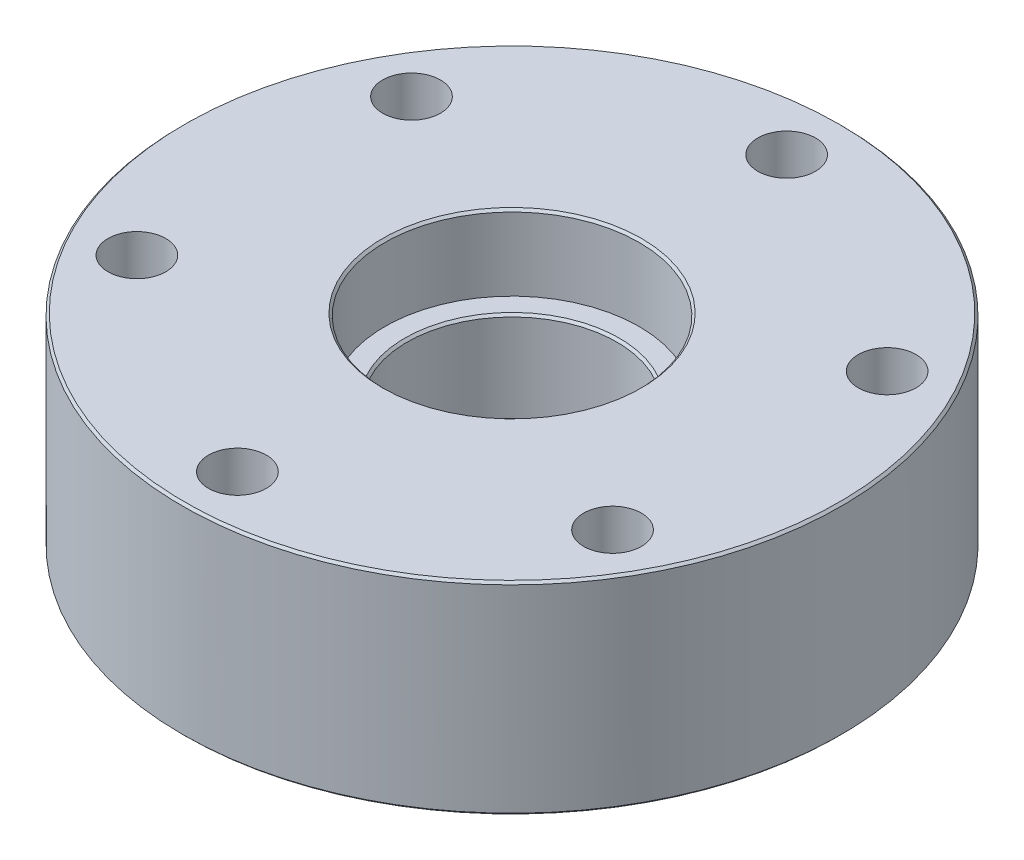
from build123d import *

# Parameters (mm, degrees)
SKETCH_3_R          = 2.5
CUT_EXTRUDE_1_DEPTH = 17.5
CHAMFER_1_SIZE      = 0.2


with BuildPart() as part:
    # ｽｹｯﾁ2 → 回転1 (revolve)
    with BuildSketch(Plane.XY, mode=Mode.PRIVATE) as revolve_1_sk:
        Polygon((-9.075, 10.244997288), (-9.075, 2.244997288), (-11, 2.244997288), (-11, -0.755002712), (-28.5, -0.755002712), (-28.5, 16.744997288), (-11, 16.744997288), (-11, 10.244997288), align=None)
    revolve(revolve_1_sk.sketch.rotate(Axis((0, 0, 0), (0, 1, 0)), 270), axis=Axis((0, 0, 0), (0, 1, 0)))

    # ｽｹｯﾁ3 → ｶｯﾄ - 押し出し1 (cut)
    with BuildSketch(Plane(origin=(0, 16.744997288, 0), x_dir=(1, 0, 0), z_dir=(0, 1, 0))):
        with Locations(Location((0, 23.75, 0), (0, 0, 270))):
            Circle(SKETCH_3_R)
        with Locations(Location((20.56810334, 11.875, 0), (0, 0, 270))):
            Circle(SKETCH_3_R)
        with Locations(Location((20.56810334, -11.875, 0), (0, 0, 270))):
            Circle(SKETCH_3_R)
        with Locations(Location((0, -23.75, 0), (0, 0, 270))):
            Circle(SKETCH_3_R)
        with Locations(Location((-20.56810334, -11.875, 0), (0, 0, 270))):
            Circle(SKETCH_3_R)
        with Locations(Location((-20.56810334, 11.875, 0), (0, 0, 270))):
            Circle(SKETCH_3_R)
    extrude(amount=-CUT_EXTRUDE_1_DEPTH, mode=Mode.SUBTRACT)

    # 面取り1
    chamfer_1_edges = [part.edges().sort_by_distance(p)[0] for p in [
        (0, 16.744997288, 11),
        (0, 16.744997288, 28.5),
        (0, -0.755002712, 28.5),
        (0, -0.755002712, 11),
        (0, 2.244997288, 9.075),
        (0, 10.244997288, 9.075),
    ]]
    chamfer(chamfer_1_edges, length=CHAMFER_1_SIZE)


solid = part.part
